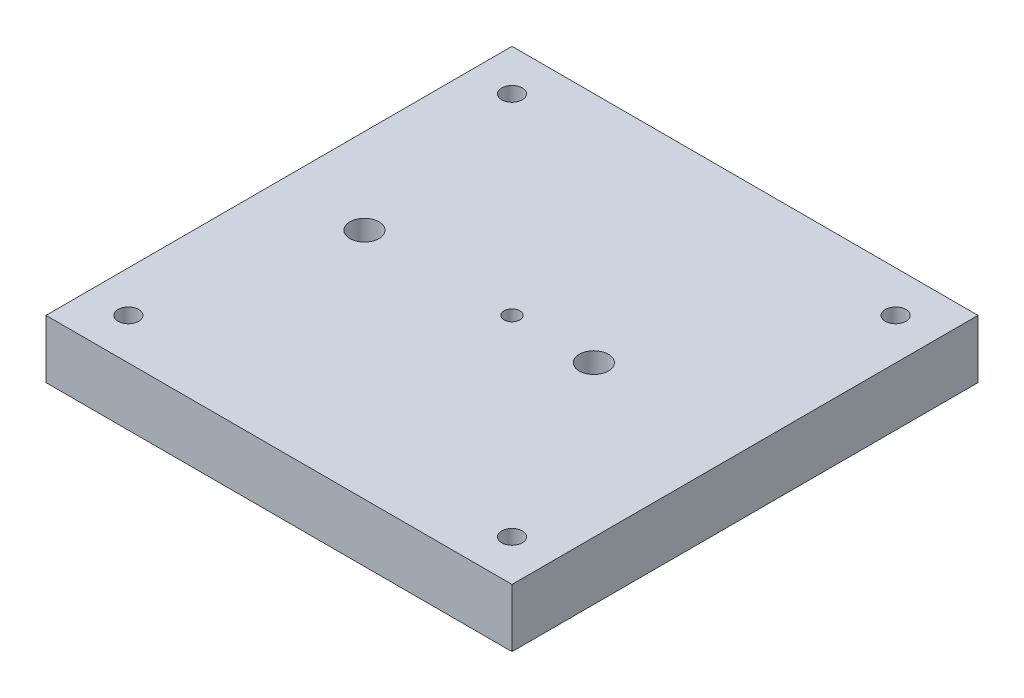
from build123d import *

# Parameters (mm, degrees)
SKETCH1_W           = 101.6
SKETCH1_H           = 101.6
BOSS_EXTRUDE1_DEPTH = 12.7
SKETCH3_R           = 3.175
SKETCH3_R_2         = 2.2479
SKETCH3_R_3         = 1.7272
CUT_EXTRUDE1_DEPTH  = 73.955945611


with BuildPart() as part:
    # Sketch1 → Boss-Extrude1 (new body)
    with BuildSketch(Plane(origin=(0, 0, 0), x_dir=(1, 0, 0), z_dir=(0, 1, 0))):
        Rectangle(SKETCH1_W, SKETCH1_H)
    extrude(amount=-BOSS_EXTRUDE1_DEPTH)

    # Sketch3 → Cut-Extrude1 (cut, through all)
    with BuildSketch(Plane(origin=(0, 0, 0), x_dir=(1, 0, 0), z_dir=(0, 1, 0))):
        with Locations(Location((17.8435508, 0, 0), (0, 0, 270))):
            Circle(SKETCH3_R)
        with Locations(Location((-32.16507791, 0, 0), (0, 0, 270))):
            Circle(SKETCH3_R)
        with Locations(Location((-41.819743879, 41.819743879, 0), (0, 0, 270))):
            Circle(SKETCH3_R_2)
        with Locations(Location((41.819743879, 41.819743879, 0), (0, 0, 270))):
            Circle(SKETCH3_R_2)
        with Locations(Location((41.819743879, -41.819743879, 0), (0, 0, 270))):
            Circle(SKETCH3_R_2)
        with Locations(Location((-41.819743879, -41.819743879, 0), (0, 0, 270))):
            Circle(SKETCH3_R_2)
        with Locations(Location((0, 0, 0), (0, 0, 270))):
            Circle(SKETCH3_R_3)
    extrude(amount=-CUT_EXTRUDE1_DEPTH, mode=Mode.SUBTRACT)


solid = part.part
